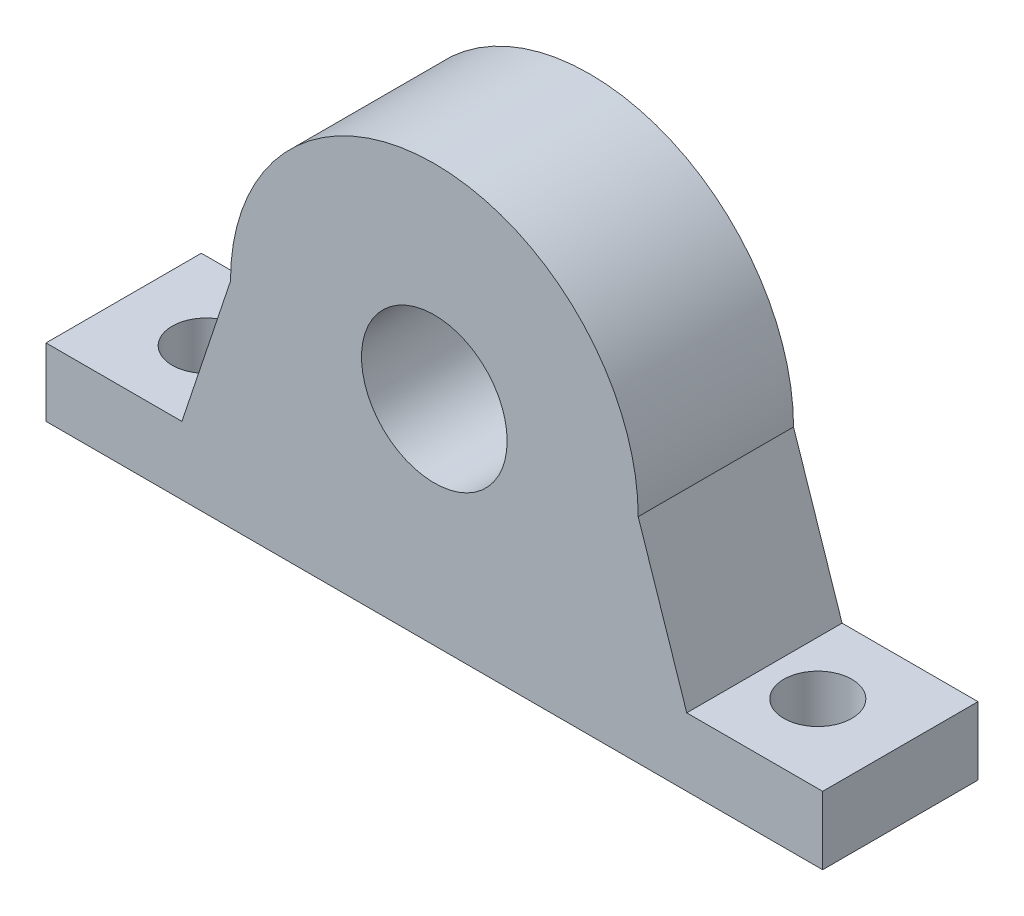
from build123d import *

# Parameters (mm, degrees)
SKETCH_1_R          = 7.5
EXTRUDE_1_DEPTH     = 16
SKETCH_3_R          = 3.5
CUT_EXTRUDE_1_DEPTH = 57.14267539


with BuildPart() as part:
    # 草图1 → 凸台-拉伸1 (new body)
    with BuildSketch(Plane.XY):
        with BuildLine():
            Line((-21, 0), (-26, -15))
            Line((-26, -15), (-40, -15))
            Line((-40, -15), (-40, -22))
            Line((-40, -22), (40, -22))
            Line((40, -22), (40, -15))
            Line((40, -15), (26, -15))
            Line((26, -15), (21, 0))
            ThreePointArc((21, 0), (0, 21), (-21, 0))
        make_face()
        Circle(SKETCH_1_R, mode=Mode.SUBTRACT)
    extrude(amount=EXTRUDE_1_DEPTH)

    # 草图3 → 切除-拉伸1 (cut, through all)
    with BuildSketch(Plane(origin=(0, -15, 0), x_dir=(1, 0, 0), z_dir=(0, 1, 0))):
        with Locations(Location((-31.5, -8, 0), (0, 0, 180))):
            Circle(SKETCH_3_R)
        with Locations(Location((31.5, -8, 0), (0, 0, 180))):
            Circle(SKETCH_3_R)
    extrude(amount=-CUT_EXTRUDE_1_DEPTH, mode=Mode.SUBTRACT)


solid = part.part
